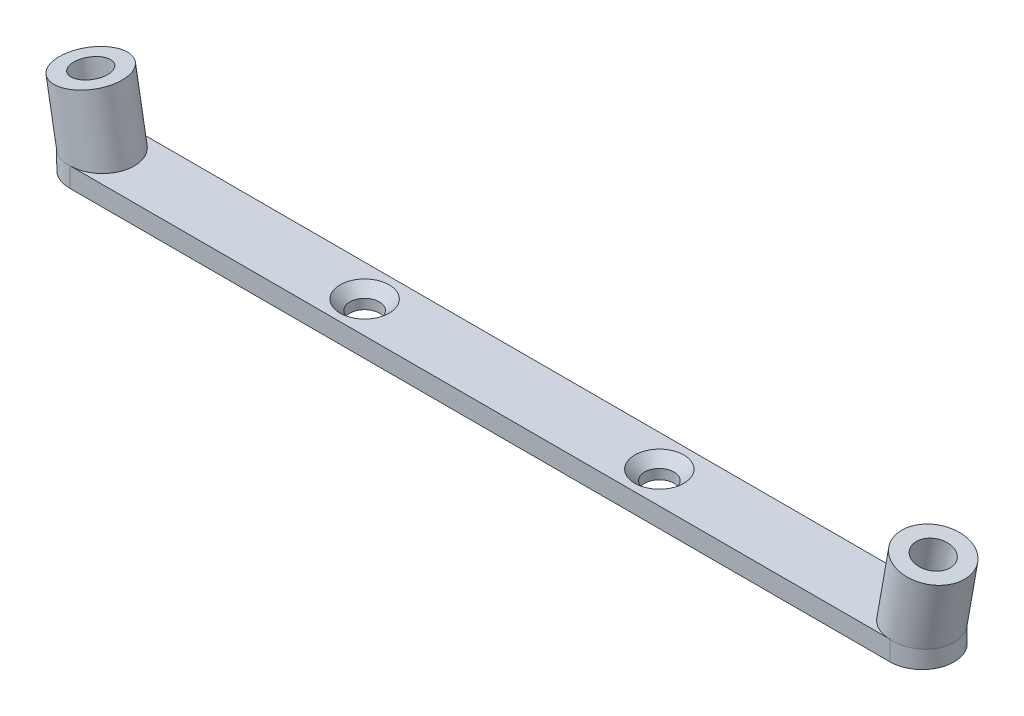
from build123d import *

# Parameters (mm, degrees)
BOSS_EXTRUDE1_DEPTH = 2
BOSS_EXTRUDE2_START = -0.573063
SKETCH2_R           = 3.25
SKETCH2_R_2         = 1.75
BOSS_EXTRUDE2_DEPTH = 7.073063
BOSS_EXTRUDE3_START = -0.573063
SKETCH3_R           = 3.25
SKETCH3_R_2         = 1.75
BOSS_EXTRUDE3_DEPTH = 7.073063
SKETCH4_R           = 1.5
CUT_EXTRUDE1_DEPTH  = 2
CHAMFER1_SIZE       = 1


with BuildPart() as part:
    # Sketch1 → Boss-Extrude1 (new body)
    with BuildSketch(Plane(origin=(0, 0, 0), x_dir=(1, 0, 0), z_dir=(0, 1, 0))):
        with BuildLine():
            Line((-41.75, 3.25), (41.75, 3.25))
            ThreePointArc((41.75, 3.25), (45, 0), (41.75, -3.25))
            Line((41.75, -3.25), (-41.75, -3.25))
            ThreePointArc((-41.75, -3.25), (-45, 0), (-41.75, 3.25))
        make_face()
    extrude(amount=BOSS_EXTRUDE1_DEPTH)

    # Sketch2 → Boss-Extrude2 (add)
    with BuildSketch(Plane(origin=(-1.600936684, 9.079363113, 0), x_dir=(0, 0, -1), z_dir=(-0.17364817766693072, 0.984807753012208, 0)).offset(BOSS_EXTRUDE2_START)):
        with Locations(Location((0, 40.768427333, 0), (0, 0, 180))):
            Circle(SKETCH2_R)
        with Locations(Location((0, 40.768427333, 0), (0, 0, 270))):
            Circle(SKETCH2_R_2, mode=Mode.SUBTRACT)
    extrude(amount=BOSS_EXTRUDE2_DEPTH)

    # Sketch3 → Boss-Extrude3 (add)
    with BuildSketch(Plane(origin=(1.600936684, 9.079363113, 0), x_dir=(0, 0, -1), z_dir=(0.17364817766693072, 0.984807753012208, 0)).offset(BOSS_EXTRUDE3_START)):
        with Locations((0, -40.768427333)):
            Circle(SKETCH3_R)
        with Locations(Location((0, -40.768427333, 0), (0, 0, 90))):
            Circle(SKETCH3_R_2, mode=Mode.SUBTRACT)
    extrude(amount=BOSS_EXTRUDE3_DEPTH)

    # Sketch4 → Cut-Extrude1 (cut)
    with BuildSketch(Plane(origin=(0, 2, 0), x_dir=(1, 0, 0), z_dir=(0, 1, 0))):
        with Locations(Location((-15, 0, 0), (0, 0, 270))):
            Circle(SKETCH4_R)
        with Locations(Location((15, 0, 0), (0, 0, 270))):
            Circle(SKETCH4_R)
    extrude(amount=-CUT_EXTRUDE1_DEPTH, mode=Mode.SUBTRACT)

    # Chamfer1
    chamfer1_edges = [part.edges().sort_by_distance(p)[0] for p in [
        (-15, 2, -1.5),
        (15, 2, -1.5),
    ]]
    chamfer(chamfer1_edges, length=CHAMFER1_SIZE)


solid = part.part
